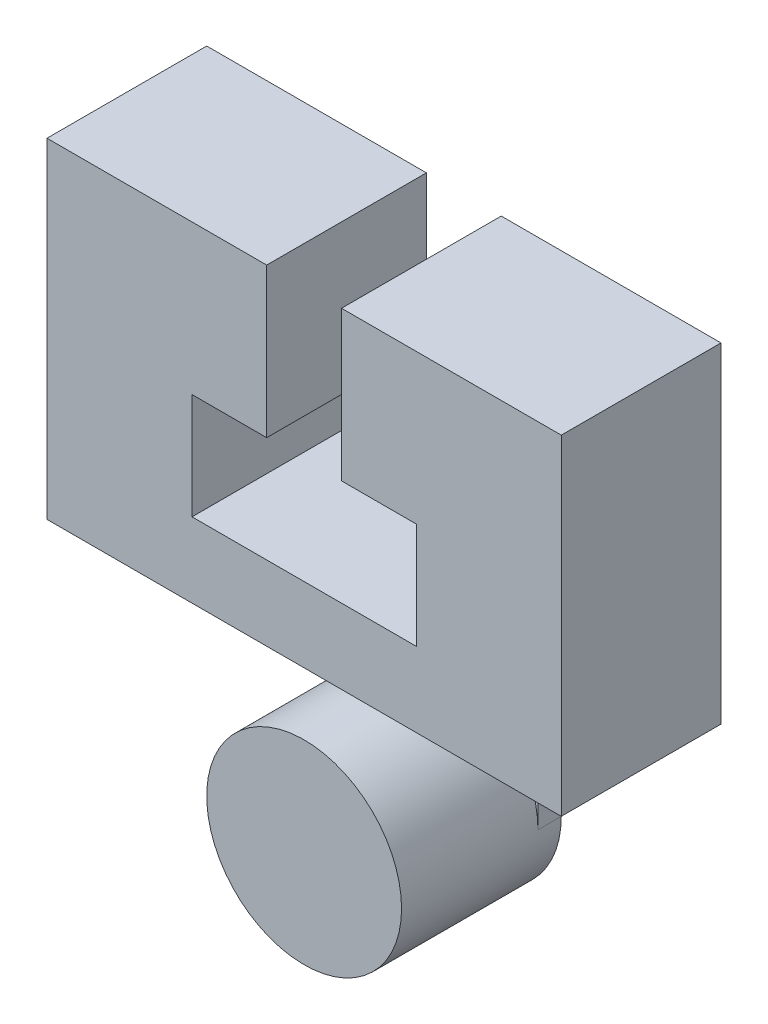
from build123d import *

# Parameters (mm, degrees)
SKETCH1_R           = 15.494
BOSS_EXTRUDE1_DEPTH = 25.4
BOSS_EXTRUDE2_START = -3.7084
BOSS_EXTRUDE2_DEPTH = 3.7084
BOSS_EXTRUDE4_DEPTH = 25.4
CUT_EXTRUDE1_DEPTH  = 92.576032231


with BuildPart() as part:
    # Sketch1 → Boss-Extrude1 (new body)
    with BuildSketch(Plane.XY):
        Circle(SKETCH1_R)
    extrude(amount=-BOSS_EXTRUDE1_DEPTH)

    # Sketch2 → Boss-Extrude2 (add)
    with BuildSketch(Plane(origin=(0, 0, -25.4), x_dir=(-1, 0, 0), z_dir=(0, 0, -1)).offset(BOSS_EXTRUDE2_START)):
        with BuildLine():
            Line((-15.494, 0), (-15.494, 25.4))
            Line((-15.494, 25.4), (15.494, 25.4))
            Line((15.494, 25.4), (15.494, 0))
            ThreePointArc((15.494, 0), (0, 15.494), (-15.494, 0))
        make_face()
    extrude(amount=BOSS_EXTRUDE2_DEPTH)

    # Sketch3 → Boss-Extrude4 (add)
    with BuildSketch(Plane(origin=(0, 0, -25.4), x_dir=(-1, 0, 0), z_dir=(0, 0, -1))):
        Polygon((-15.494, 25.4), (-40.894, 25.4), (-40.894, 77.9018), (40.894, 77.9018), (40.894, 25.4), (15.494, 25.4), align=None)
    extrude(amount=-BOSS_EXTRUDE4_DEPTH)

    # Sketch4 → Cut-Extrude1 (cut, through all)
    with BuildSketch(Plane(origin=(0, 0, -25.4), x_dir=(-1, 0, 0), z_dir=(0, 0, -1))):
        Polygon((-5.94478872, 77.9018), (-5.94478872, 54.1274), (-17.8308, 54.1274), (-17.8308, 37.2872), (17.8308, 37.2872), (17.8308, 54.1274), (5.9554872, 54.1274), (5.9554872, 77.9018), align=None)
    extrude(amount=-CUT_EXTRUDE1_DEPTH, mode=Mode.SUBTRACT)


solid = part.part
